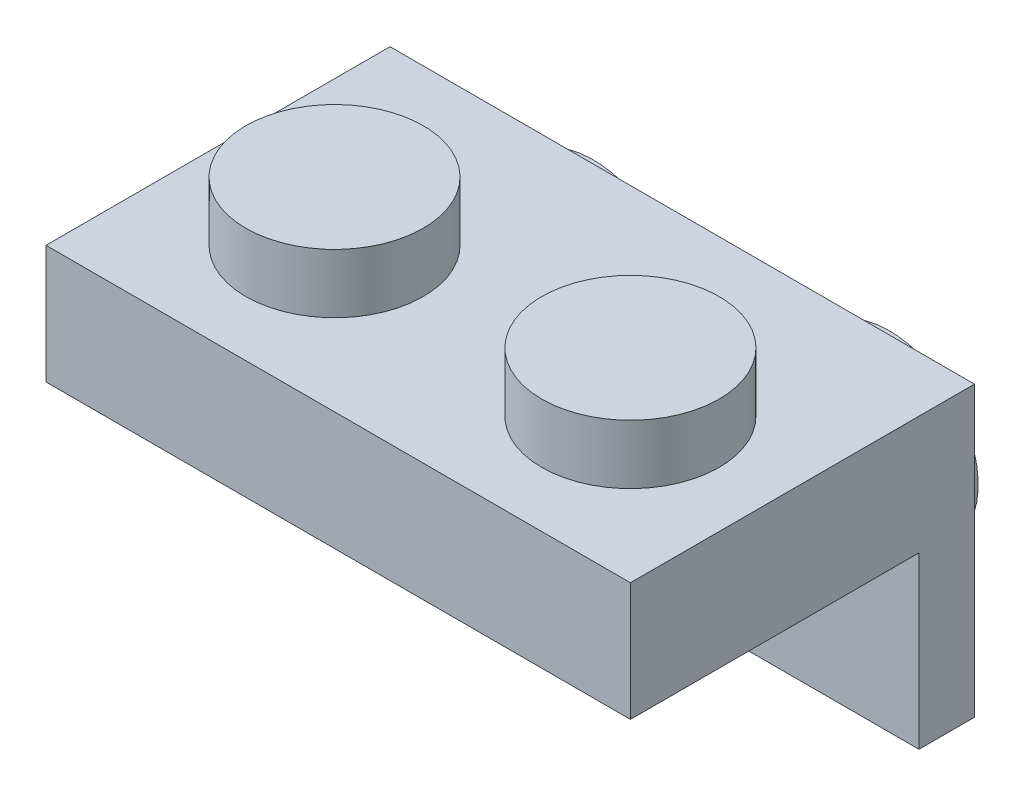
from build123d import *

# Parameters (mm, degrees)
SKETCH1_W            = 15.8
SKETCH1_H            = 3.2
BOSS_EXTRUDE1_DEPTH  = 7.8
SKETCH2_R            = 2.4
BOSS_EXTRUDE2_DEPTH  = 1.6
LPATTERN1_COUNT      = 2
LPATTERN1_PITCH      = 8
LPATTERN1_COUNT_DIR2 = 6
LPATTERN1_PITCH_DIR2 = 8
SHELL1_T             = -1.2
SKETCH3_R            = 1.5
SKETCH3_R_2          = 0.6
BOSS_EXTRUDE3_DEPTH  = 1.8
SKETCH4_W            = 15.8
SKETCH4_H            = 7.8
BOSS_EXTRUDE4_DEPTH  = 1.5
SKETCH5_R            = 2.4
SKETCH5_R_2          = 1.55
BOSS_EXTRUDE5_DEPTH  = 1.6
LPATTERN2_COUNT      = 2
LPATTERN2_PITCH      = 8


with BuildPart() as part:
    # Sketch1 → Boss-Extrude1 (new body)
    with BuildSketch(Plane.XY):
        with Locations((7.9, 1.6)):
            Rectangle(SKETCH1_W, SKETCH1_H)
    extrude(amount=-BOSS_EXTRUDE1_DEPTH)

    # Sketch2 → Boss-Extrude2 (add)
    with BuildSketch(Plane(origin=(0, 3.2, 0), x_dir=(1, 0, 0), z_dir=(0, 1, 0))):
        with Locations(Location((3.9, 3.9, 0), (0, 0, 270))):
            Circle(SKETCH2_R)
    boss_extrude2 = extrude(amount=BOSS_EXTRUDE2_DEPTH)

    # LPattern1: Boss-Extrude2 2 × 6, 10 skipped
    with Locations(*[(j * LPATTERN1_PITCH_DIR2, 0, i * LPATTERN1_PITCH) for i in range(LPATTERN1_COUNT) for j in range(LPATTERN1_COUNT_DIR2) if (i, j) not in ((0, 0), (0, 2), (0, 3), (0, 4), (0, 5), (1, 0), (1, 1), (1, 2), (1, 3), (1, 4), (1, 5))]):
        add(boss_extrude2)

    # Shell1
    shell1_openings = [part.faces().sort_by_distance(p)[0] for p in [
        (7.9, 0, -3.9),
    ]]
    offset(amount=SHELL1_T, openings=shell1_openings, kind=Kind.INTERSECTION)

    # Sketch3 → Boss-Extrude3 (add)
    with BuildSketch(Plane.XZ.offset(-2)):
        with Locations(Location((7.9, -3.9, 0), (0, 0, 90))):
            Circle(SKETCH3_R)
        with Locations(Location((7.9, -3.9, 0), (0, 0, 270))):
            Circle(SKETCH3_R_2, mode=Mode.SUBTRACT)
    extrude(amount=BOSS_EXTRUDE3_DEPTH)

    # Sketch4 → Boss-Extrude4 (add)
    with BuildSketch(Plane(origin=(0, 0, -7.8), x_dir=(-1, 0, 0), z_dir=(0, 0, -1))):
        with Locations((-7.9, -0.7)):
            Rectangle(SKETCH4_W, SKETCH4_H)
    extrude(amount=BOSS_EXTRUDE4_DEPTH)

    # Sketch5 → Boss-Extrude5 (add)
    with BuildSketch(Plane(origin=(0, 0, -9.3), x_dir=(-1, 0, 0), z_dir=(0, 0, -1))):
        with Locations((-3.9, -0.7)):
            Circle(SKETCH5_R)
        with Locations((-3.9, -0.7)):
            Circle(SKETCH5_R_2, mode=Mode.SUBTRACT)
    boss_extrude5 = extrude(amount=BOSS_EXTRUDE5_DEPTH)

    # LPattern2: Boss-Extrude5 ×2
    with Locations(*[(i * LPATTERN2_PITCH, 0, 0) for i in range(1, LPATTERN2_COUNT)]):
        add(boss_extrude5)


solid = part.part
